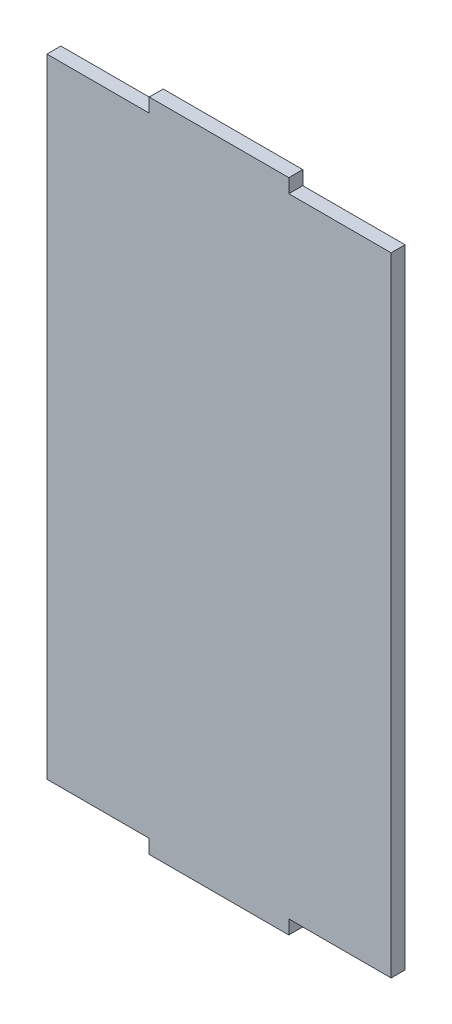
from build123d import *

# Parameters (mm, degrees)
RESSALTO_EXTRUS_O1_DEPTH = 3


with BuildPart() as part:
    # Esboço1 → Ressalto-extrusão1 (new body)
    with BuildSketch(Plane.XY):
        Polygon((52, 0), (74, 0), (74, 135), (52, 135), (52, 138), (22, 138), (22, 135), (0, 135), (0, 0), (22, 0), (22, -3), (52, -3), align=None)
    extrude(amount=RESSALTO_EXTRUS_O1_DEPTH)


solid = part.part
